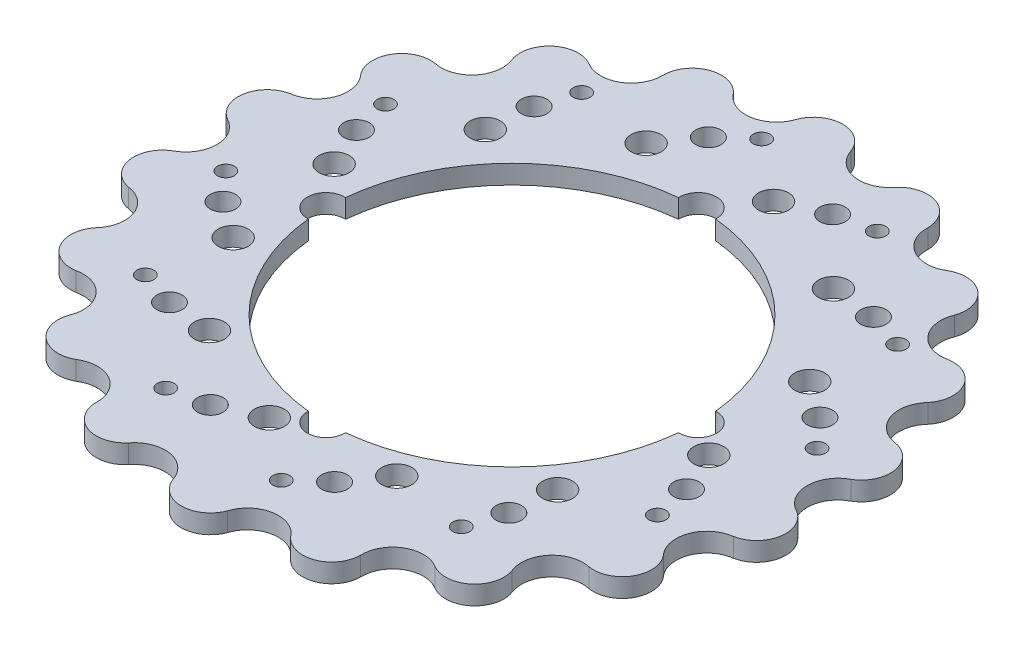
from build123d import *

# Parameters (mm, degrees)
SKETCH2_R           = 79.375
BOSS_EXTRUDE1_DEPTH = 5.08
SKETCH3_R           = 50
SKETCH3_R_2         = 5
CUT_EXTRUDE1_DEPTH  = 125.959040859
SKETCH4_R           = 4.035126609
SKETCH4_R_2         = 3.424460764
SKETCH4_R_3         = 2.259606703
CUT_EXTRUDE3_DEPTH  = 125.959040859


with BuildPart() as part:
    # Sketch2 → Boss-Extrude1 (new body)
    with BuildSketch(Plane(origin=(0, 0, 0), x_dir=(1, 0, 0), z_dir=(0, 1, 0))):
        with BuildLine():
            ThreePointArc((-48.259287413, 68.921405126), (-52.829758748, 69.900369699), (-57.143818501, 68.101350993))
            ThreePointArc((-57.143818501, 68.101350993), (-59.664634685, 64.165227821), (-59.494196802, 59.494196802))
            ThreePointArc((-59.494196802, 59.494196802), (-54.08254251, 64.453064333), (-48.259287413, 68.921405126))
        make_face()
        with BuildLine():
            ThreePointArc((-48.259287413, 68.921405126), (-54.08254251, 64.453064333), (-59.494196802, 59.494196802))
            ThreePointArc((-59.494196802, 59.494196802), (-58.966355922, 55.074726582), (-60.804777673, 51.021266519))
            ThreePointArc((-60.804777673, 51.021266519), (-51.021266519, 60.804777673), (-39.6875, 68.740766425))
            ThreePointArc((-39.6875, 68.740766425), (-43.998617484, 67.634150386), (-48.259287413, 68.921405126))
        make_face()
        with BuildLine():
            ThreePointArc((-21.776387407, 81.270584209), (-25.736399991, 83.753703255), (-30.405590742, 83.538673988))
            ThreePointArc((-30.405590742, 83.538673988), (-34.120616519, 80.702098001), (-35.558043997, 76.254471432))
            ThreePointArc((-35.558043997, 76.254471432), (-28.776719809, 79.063387881), (-21.776387407, 81.270584209))
        make_face()
        with BuildLine():
            ThreePointArc((-21.776387407, 81.270584209), (-28.776719809, 79.063387881), (-35.558043997, 76.254471432))
            ThreePointArc((-35.558043997, 76.254471432), (-36.573583655, 71.920995665), (-39.6875, 68.740766425))
            ThreePointArc((-39.6875, 68.740766425), (-27.147848876, 74.588101775), (-13.783324102, 78.169115395))
            ThreePointArc((-13.783324102, 78.169115395), (-18.212934366, 78.603725488), (-21.776387407, 81.270584209))
        make_face()
        with BuildLine():
            ThreePointArc((13.783324102, 78.169115395), (9.769497431, 80.09253123), (7.333066305, 83.817331411))
            ThreePointArc((7.333066305, 83.817331411), (0, 84.1375), (-7.333066305, 83.817331411))
            ThreePointArc((-7.333066305, 83.817331411), (-9.769497431, 80.09253123), (-13.783324102, 78.169115395))
            ThreePointArc((-13.783324102, 78.169115395), (0, 79.375), (13.783324102, 78.169115395))
        make_face()
        with BuildLine():
            ThreePointArc((7.333066305, 83.817331411), (4.461148435, 87.505104126), (0, 88.9))
            ThreePointArc((0, 88.9), (-4.461148435, 87.505104126), (-7.333066305, 83.817331411))
            ThreePointArc((-7.333066305, 83.817331411), (0, 84.1375), (7.333066305, 83.817331411))
        make_face()
        with BuildLine():
            ThreePointArc((35.558043997, 76.254471432), (28.776719809, 79.063387881), (21.776387407, 81.270584209))
            ThreePointArc((21.776387407, 81.270584209), (18.212934366, 78.603725488), (13.783324102, 78.169115395))
            ThreePointArc((13.783324102, 78.169115395), (27.147848876, 74.588101775), (39.6875, 68.740766425))
            ThreePointArc((39.6875, 68.740766425), (36.573583655, 71.920995665), (35.558043997, 76.254471432))
        make_face()
        with BuildLine():
            ThreePointArc((35.558043997, 76.254471432), (34.120616519, 80.702098001), (30.405590742, 83.538673988))
            ThreePointArc((30.405590742, 83.538673988), (25.736399991, 83.753703255), (21.776387407, 81.270584209))
            ThreePointArc((21.776387407, 81.270584209), (28.776719809, 79.063387881), (35.558043997, 76.254471432))
        make_face()
        with BuildLine():
            ThreePointArc((59.494196802, 59.494196802), (59.664634685, 64.165227821), (57.143818501, 68.101350993))
            ThreePointArc((57.143818501, 68.101350993), (52.829758748, 69.900369699), (48.259287413, 68.921405126))
            ThreePointArc((48.259287413, 68.921405126), (54.08254251, 64.453064333), (59.494196802, 59.494196802))
        make_face()
        with BuildLine():
            ThreePointArc((59.494196802, 59.494196802), (54.08254251, 64.453064333), (48.259287413, 68.921405126))
            ThreePointArc((48.259287413, 68.921405126), (43.998617484, 67.634150386), (39.6875, 68.740766425))
            ThreePointArc((39.6875, 68.740766425), (51.021266519, 60.804777673), (60.804777673, 51.021266519))
            ThreePointArc((60.804777673, 51.021266519), (58.966355922, 55.074726582), (59.494196802, 59.494196802))
        make_face()
        with BuildLine():
            ThreePointArc((76.254471432, 35.558043997), (72.865212411, 42.06875), (68.921405126, 48.259287413))
            ThreePointArc((68.921405126, 48.259287413), (64.477417983, 48.506898573), (60.804777673, 51.021266519))
            ThreePointArc((60.804777673, 51.021266519), (68.740766425, 39.6875), (74.588101775, 27.147848876))
            ThreePointArc((74.588101775, 27.147848876), (74.246915414, 31.585632657), (76.254471432, 35.558043997))
        make_face()
        with BuildLine():
            ThreePointArc((76.254471432, 35.558043997), (78.012217351, 39.889084188), (76.989658396, 44.45))
            ThreePointArc((76.989658396, 44.45), (73.551068917, 47.616019938), (68.921405126, 48.259287413))
            ThreePointArc((68.921405126, 48.259287413), (72.865212411, 42.06875), (76.254471432, 35.558043997))
        make_face()
        with BuildLine():
            ThreePointArc((83.817331411, 7.333066305), (82.859262319, 14.610323548), (81.270584209, 21.776387407))
            ThreePointArc((81.270584209, 21.776387407), (77.179290288, 23.528998906), (74.588101775, 27.147848876))
            ThreePointArc((74.588101775, 27.147848876), (78.169115395, 13.783324102), (79.375, 0))
            ThreePointArc((79.375, 0), (80.572201139, 4.28684528), (83.817331411, 7.333066305))
        make_face()
        with BuildLine():
            ThreePointArc((83.817331411, 7.333066305), (86.950375268, 10.801728302), (87.549409243, 15.437322995))
            ThreePointArc((87.549409243, 15.437322995), (85.401034676, 19.588475434), (81.270584209, 21.776387407))
            ThreePointArc((81.270584209, 21.776387407), (82.859262319, 14.610323548), (83.817331411, 7.333066305))
        make_face()
        with BuildLine():
            ThreePointArc((81.270584209, -21.776387407), (82.859262319, -14.610323548), (83.817331411, -7.333066305))
            ThreePointArc((83.817331411, -7.333066305), (80.572201139, -4.28684528), (79.375, 0))
            ThreePointArc((79.375, 0), (78.169115395, -13.783324102), (74.588101775, -27.147848876))
            ThreePointArc((74.588101775, -27.147848876), (77.179290288, -23.528998906), (81.270584209, -21.776387407))
        make_face()
        with BuildLine():
            ThreePointArc((81.270584209, -21.776387407), (85.401034676, -19.588475434), (87.549409243, -15.437322995))
            ThreePointArc((87.549409243, -15.437322995), (86.950375268, -10.801728302), (83.817331411, -7.333066305))
            ThreePointArc((83.817331411, -7.333066305), (82.859262319, -14.610323548), (81.270584209, -21.776387407))
        make_face()
        with BuildLine():
            ThreePointArc((68.921405126, -48.259287413), (72.865212411, -42.06875), (76.254471432, -35.558043997))
            ThreePointArc((76.254471432, -35.558043997), (74.246915414, -31.585632657), (74.588101775, -27.147848876))
            ThreePointArc((74.588101775, -27.147848876), (68.740766425, -39.6875), (60.804777673, -51.021266519))
            ThreePointArc((60.804777673, -51.021266519), (64.477417983, -48.506898573), (68.921405126, -48.259287413))
        make_face()
        with BuildLine():
            ThreePointArc((68.921405126, -48.259287413), (73.551068917, -47.616019938), (76.989658396, -44.45))
            ThreePointArc((76.989658396, -44.45), (78.012217351, -39.889084188), (76.254471432, -35.558043997))
            ThreePointArc((76.254471432, -35.558043997), (72.865212411, -42.06875), (68.921405126, -48.259287413))
        make_face()
        with BuildLine():
            ThreePointArc((48.259287413, -68.921405126), (54.08254251, -64.453064333), (59.494196802, -59.494196802))
            ThreePointArc((59.494196802, -59.494196802), (58.966355922, -55.074726582), (60.804777673, -51.021266519))
            ThreePointArc((60.804777673, -51.021266519), (51.021266519, -60.804777673), (39.6875, -68.740766425))
            ThreePointArc((39.6875, -68.740766425), (43.998617484, -67.634150386), (48.259287413, -68.921405126))
        make_face()
        with BuildLine():
            ThreePointArc((48.259287413, -68.921405126), (52.829758748, -69.900369699), (57.143818501, -68.101350993))
            ThreePointArc((57.143818501, -68.101350993), (59.664634685, -64.165227821), (59.494196802, -59.494196802))
            ThreePointArc((59.494196802, -59.494196802), (54.08254251, -64.453064333), (48.259287413, -68.921405126))
        make_face()
        with BuildLine():
            ThreePointArc((21.776387407, -81.270584209), (28.776719809, -79.063387881), (35.558043997, -76.254471432))
            ThreePointArc((35.558043997, -76.254471432), (36.573583655, -71.920995665), (39.6875, -68.740766425))
            ThreePointArc((39.6875, -68.740766425), (27.147848876, -74.588101775), (13.783324102, -78.169115395))
            ThreePointArc((13.783324102, -78.169115395), (18.212934366, -78.603725488), (21.776387407, -81.270584209))
        make_face()
        with BuildLine():
            ThreePointArc((21.776387407, -81.270584209), (25.736399991, -83.753703255), (30.405590742, -83.538673988))
            ThreePointArc((30.405590742, -83.538673988), (34.120616519, -80.702098001), (35.558043997, -76.254471432))
            ThreePointArc((35.558043997, -76.254471432), (28.776719809, -79.063387881), (21.776387407, -81.270584209))
        make_face()
        with BuildLine():
            ThreePointArc((-7.333066305, -83.817331411), (0, -84.1375), (7.333066305, -83.817331411))
            ThreePointArc((7.333066305, -83.817331411), (9.769497431, -80.09253123), (13.783324102, -78.169115395))
            ThreePointArc((13.783324102, -78.169115395), (0, -79.375), (-13.783324102, -78.169115395))
            ThreePointArc((-13.783324102, -78.169115395), (-9.769497431, -80.09253123), (-7.333066305, -83.817331411))
        make_face()
        with BuildLine():
            ThreePointArc((-7.333066305, -83.817331411), (-4.461148435, -87.505104126), (0, -88.9))
            ThreePointArc((0, -88.9), (4.461148435, -87.505104126), (7.333066305, -83.817331411))
            ThreePointArc((7.333066305, -83.817331411), (0, -84.1375), (-7.333066305, -83.817331411))
        make_face()
        with BuildLine():
            ThreePointArc((-35.558043997, -76.254471432), (-28.776719809, -79.063387881), (-21.776387407, -81.270584209))
            ThreePointArc((-21.776387407, -81.270584209), (-18.212934366, -78.603725488), (-13.783324102, -78.169115395))
            ThreePointArc((-13.783324102, -78.169115395), (-27.147848876, -74.588101775), (-39.6875, -68.740766425))
            ThreePointArc((-39.6875, -68.740766425), (-36.573583655, -71.920995665), (-35.558043997, -76.254471432))
        make_face()
        with BuildLine():
            ThreePointArc((-35.558043997, -76.254471432), (-34.120616519, -80.702098001), (-30.405590742, -83.538673988))
            ThreePointArc((-30.405590742, -83.538673988), (-25.736399991, -83.753703255), (-21.776387407, -81.270584209))
            ThreePointArc((-21.776387407, -81.270584209), (-28.776719809, -79.063387881), (-35.558043997, -76.254471432))
        make_face()
        with BuildLine():
            ThreePointArc((-59.494196802, -59.494196802), (-54.08254251, -64.453064333), (-48.259287413, -68.921405126))
            ThreePointArc((-48.259287413, -68.921405126), (-43.998617484, -67.634150386), (-39.6875, -68.740766425))
            ThreePointArc((-39.6875, -68.740766425), (-51.021266519, -60.804777673), (-60.804777673, -51.021266519))
            ThreePointArc((-60.804777673, -51.021266519), (-58.966355922, -55.074726582), (-59.494196802, -59.494196802))
        make_face()
        with BuildLine():
            ThreePointArc((-59.494196802, -59.494196802), (-59.664634685, -64.165227821), (-57.143818501, -68.101350993))
            ThreePointArc((-57.143818501, -68.101350993), (-52.829758748, -69.900369699), (-48.259287413, -68.921405126))
            ThreePointArc((-48.259287413, -68.921405126), (-54.08254251, -64.453064333), (-59.494196802, -59.494196802))
        make_face()
        with BuildLine():
            ThreePointArc((-76.254471432, -35.558043997), (-72.865212411, -42.06875), (-68.921405126, -48.259287413))
            ThreePointArc((-68.921405126, -48.259287413), (-64.477417983, -48.506898573), (-60.804777673, -51.021266519))
            ThreePointArc((-60.804777673, -51.021266519), (-68.740766425, -39.6875), (-74.588101775, -27.147848876))
            ThreePointArc((-74.588101775, -27.147848876), (-74.246915414, -31.585632657), (-76.254471432, -35.558043997))
        make_face()
        with BuildLine():
            ThreePointArc((-76.254471432, -35.558043997), (-78.012217351, -39.889084188), (-76.989658396, -44.45))
            ThreePointArc((-76.989658396, -44.45), (-73.551068917, -47.616019938), (-68.921405126, -48.259287413))
            ThreePointArc((-68.921405126, -48.259287413), (-72.865212411, -42.06875), (-76.254471432, -35.558043997))
        make_face()
        Circle(SKETCH2_R)
        with BuildLine():
            ThreePointArc((-83.817331411, -7.333066305), (-86.950375268, -10.801728302), (-87.549409243, -15.437322995))
            ThreePointArc((-87.549409243, -15.437322995), (-85.401034676, -19.588475434), (-81.270584209, -21.776387407))
            ThreePointArc((-81.270584209, -21.776387407), (-82.859262319, -14.610323548), (-83.817331411, -7.333066305))
        make_face()
        with BuildLine():
            ThreePointArc((-81.270584209, 21.776387407), (-85.401034676, 19.588475434), (-87.549409243, 15.437322995))
            ThreePointArc((-87.549409243, 15.437322995), (-86.950375268, 10.801728302), (-83.817331411, 7.333066305))
            ThreePointArc((-83.817331411, 7.333066305), (-82.859262319, 14.610323548), (-81.270584209, 21.776387407))
        make_face()
        with BuildLine():
            ThreePointArc((-68.921405126, 48.259287413), (-73.551068917, 47.616019938), (-76.989658396, 44.45))
            ThreePointArc((-76.989658396, 44.45), (-78.012217351, 39.889084188), (-76.254471432, 35.558043997))
            ThreePointArc((-76.254471432, 35.558043997), (-72.865212411, 42.06875), (-68.921405126, 48.259287413))
        make_face()
        with BuildLine():
            ThreePointArc((-68.921405126, 48.259287413), (-72.865212411, 42.06875), (-76.254471432, 35.558043997))
            ThreePointArc((-76.254471432, 35.558043997), (-74.246915414, 31.585632657), (-74.588101775, 27.147848876))
            ThreePointArc((-74.588101775, 27.147848876), (-68.740766425, 39.6875), (-60.804777673, 51.021266519))
            ThreePointArc((-60.804777673, 51.021266519), (-64.477417983, 48.506898573), (-68.921405126, 48.259287413))
        make_face()
        with BuildLine():
            ThreePointArc((-81.270584209, 21.776387407), (-82.859262319, 14.610323548), (-83.817331411, 7.333066305))
            ThreePointArc((-83.817331411, 7.333066305), (-80.572201139, 4.28684528), (-79.375, 0))
            ThreePointArc((-79.375, 0), (-78.169115395, 13.783324102), (-74.588101775, 27.147848876))
            ThreePointArc((-74.588101775, 27.147848876), (-77.179290288, 23.528998906), (-81.270584209, 21.776387407))
        make_face()
        with BuildLine():
            ThreePointArc((-83.817331411, -7.333066305), (-82.859262319, -14.610323548), (-81.270584209, -21.776387407))
            ThreePointArc((-81.270584209, -21.776387407), (-77.179290288, -23.528998906), (-74.588101775, -27.147848876))
            ThreePointArc((-74.588101775, -27.147848876), (-78.169115395, -13.783324102), (-79.375, 0))
            ThreePointArc((-79.375, 0), (-80.572201139, -4.28684528), (-83.817331411, -7.333066305))
        make_face()
    extrude(amount=BOSS_EXTRUDE1_DEPTH)

    # Sketch3 → Cut-Extrude1 (cut, through all)
    with BuildSketch(Plane(origin=(0, 5.08, 0), x_dir=(1, 0, 0), z_dir=(0, 1, 0))):
        Circle(SKETCH3_R)
        with Locations((0, 50)):
            Circle(SKETCH3_R_2)
        with Locations((-50, 0)):
            Circle(SKETCH3_R_2)
        with Locations((50, 0)):
            Circle(SKETCH3_R_2)
        with Locations((0, -50)):
            Circle(SKETCH3_R_2)
    extrude(amount=-CUT_EXTRUDE1_DEPTH, mode=Mode.SUBTRACT)

    # Sketch4 → Cut-Extrude3 (cut, through all)
    with BuildSketch(Plane(origin=(0, 5.08, 0), x_dir=(1, 0, 0), z_dir=(0, 1, 0))):
        with Locations(Location((8.709228258, 61.609264585, 0), (0, 0, 270))):
            Circle(SKETCH4_R)
        with Locations(Location((19.636546728, 66.55036178, 0), (0, 0, 270))):
            Circle(SKETCH4_R_2)
        with Locations(Location((29.553775935, 68.643430263, 0), (0, 0, 270))):
            Circle(SKETCH4_R_3)
        with Locations(Location((37.077045211, 49.340869584, 0), (0, 0, 270))):
            Circle(SKETCH4_R)
        with Locations(Location((49.010929199, 48.156326042, 0), (0, 0, 270))):
            Circle(SKETCH4_R_2)
        with Locations(Location((58.646035869, 45.010361917, 0), (0, 0, 270))):
            Circle(SKETCH4_R_3)
        with Locations(Location((55.510097842, 24.532219374, 0), (0, 0, 270))):
            Circle(SKETCH4_R)
        with Locations(Location((65.252872771, 17.539432581, 0), (0, 0, 270))):
            Circle(SKETCH4_R_2)
        with Locations(Location((72.024137852, 9.997394394, 0), (0, 0, 270))):
            Circle(SKETCH4_R_3)
        with Locations(Location((59.069264585, -6.169228258, 0), (0, 0, 270))):
            Circle(SKETCH4_R)
        with Locations(Location((64.01036178, -17.096546728, 0), (0, 0, 270))):
            Circle(SKETCH4_R_2)
        with Locations(Location((66.103430263, -27.013775935, 0), (0, 0, 270))):
            Circle(SKETCH4_R_3)
        with Locations(Location((46.800869584, -34.537045211, 0), (0, 0, 270))):
            Circle(SKETCH4_R)
        with Locations(Location((45.616326042, -46.470929199, 0), (0, 0, 270))):
            Circle(SKETCH4_R_2)
        with Locations(Location((42.470361917, -56.106035869, 0), (0, 0, 270))):
            Circle(SKETCH4_R_3)
        with Locations(Location((21.992219374, -52.970097842, 0), (0, 0, 270))):
            Circle(SKETCH4_R)
        with Locations(Location((14.999432581, -62.712872771, 0), (0, 0, 270))):
            Circle(SKETCH4_R_2)
        with Locations(Location((7.457394394, -69.484137852, 0), (0, 0, 270))):
            Circle(SKETCH4_R_3)
        with Locations(Location((-8.709228258, -56.529264585, 0), (0, 0, 270))):
            Circle(SKETCH4_R)
        with Locations(Location((-19.636546728, -61.47036178, 0), (0, 0, 270))):
            Circle(SKETCH4_R_2)
        with Locations(Location((-29.553775935, -63.563430263, 0), (0, 0, 270))):
            Circle(SKETCH4_R_3)
        with Locations(Location((-37.077045211, -44.260869584, 0), (0, 0, 270))):
            Circle(SKETCH4_R)
        with Locations(Location((-49.010929199, -43.076326042, 0), (0, 0, 270))):
            Circle(SKETCH4_R_2)
        with Locations(Location((-58.646035869, -39.930361917, 0), (0, 0, 270))):
            Circle(SKETCH4_R_3)
        with Locations(Location((-55.510097842, -19.452219374, 0), (0, 0, 270))):
            Circle(SKETCH4_R)
        with Locations(Location((-65.252872771, -12.459432581, 0), (0, 0, 270))):
            Circle(SKETCH4_R_2)
        with Locations(Location((-72.024137852, -4.917394394, 0), (0, 0, 270))):
            Circle(SKETCH4_R_3)
        with Locations(Location((-59.069264585, 11.249228258, 0), (0, 0, 270))):
            Circle(SKETCH4_R)
        with Locations(Location((-64.01036178, 22.176546728, 0), (0, 0, 270))):
            Circle(SKETCH4_R_2)
        with Locations(Location((-66.103430263, 32.093775935, 0), (0, 0, 270))):
            Circle(SKETCH4_R_3)
        with Locations(Location((-46.800869584, 39.617045211, 0), (0, 0, 270))):
            Circle(SKETCH4_R)
        with Locations(Location((-45.616326042, 51.550929199, 0), (0, 0, 270))):
            Circle(SKETCH4_R_2)
        with Locations(Location((-42.470361917, 61.186035869, 0), (0, 0, 270))):
            Circle(SKETCH4_R_3)
        with Locations(Location((-21.992219374, 58.050097842, 0), (0, 0, 270))):
            Circle(SKETCH4_R)
        with Locations(Location((-14.999432581, 67.792872771, 0), (0, 0, 270))):
            Circle(SKETCH4_R_2)
        with Locations(Location((-7.457394394, 74.564137852, 0), (0, 0, 270))):
            Circle(SKETCH4_R_3)
    extrude(amount=-CUT_EXTRUDE3_DEPTH, mode=Mode.SUBTRACT)


solid = part.part
